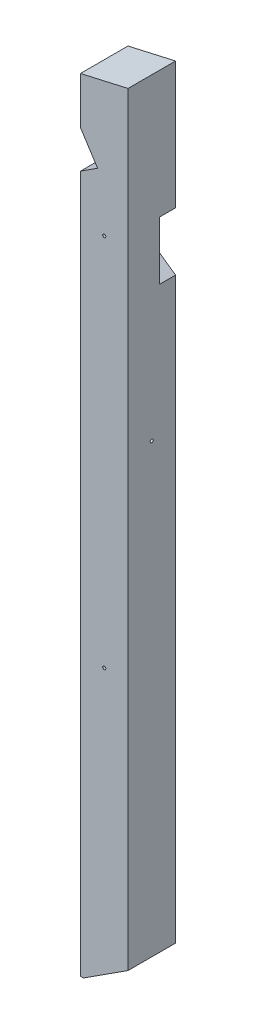
from build123d import *

# Parameters (mm, degrees)
SKETCH1_W           = 150
SKETCH1_H           = 150
BOSS_EXTRUDE1_DEPTH = 1250
SKETCH2_R           = 5
BOLTS_DEPTH         = 1262.199825563
TOPCUT_DEPTH        = 1262.199825563
ROOFCUT_DEPTH       = 1262.199825563
CUT_EXTRUDE4_DEPTH  = 1262.199825563
SKETCH6_R           = 5
CUT_EXTRUDE5_DEPTH  = 1262.199825563
CUT_EXTRUDE6_DEPTH  = 50


with BuildPart() as part:
    # Sketch1 → Boss-Extrude1 (new, symmetric)
    with BuildSketch(Plane(origin=(0, 0, 0), x_dir=(1, 0, 0), z_dir=(0, 1, 0))):
        Rectangle(SKETCH1_W, SKETCH1_H)
    extrude(amount=BOSS_EXTRUDE1_DEPTH, both=True)

    # Sketch2 → Bolts (cut, through all)
    with BuildSketch(Plane.XY.offset(75)):
        with Locations((0, 810)):
            Circle(SKETCH2_R)
        with Locations((0, -370)):
            Circle(SKETCH2_R)
    extrude(amount=-BOLTS_DEPTH, mode=Mode.SUBTRACT)

    # Sketch3 → TopCut (cut, through all)
    with BuildSketch(Plane.XY.offset(75)):
        Polygon((-75, 1068.159196847), (-20.84827249, 984.090234633), (-75, 949.20923319), align=None)
    extrude(amount=-TOPCUT_DEPTH, mode=Mode.SUBTRACT)

    # Sketch4 → RoofCut (cut, through all)
    with BuildSketch(Plane.XY.offset(75)):
        Polygon((75, 1250), (-75, 1215.956662981), (-75, 1250), align=None)
    extrude(amount=-ROOFCUT_DEPTH, mode=Mode.SUBTRACT)

    # Sketch5 → Cut-Extrude4 (cut, through all)
    with BuildSketch(Plane.XY.offset(75)):
        Polygon((75, -1159.47022319), (-65.544812434, -1250), (75, -1250), align=None)
    extrude(amount=-CUT_EXTRUDE4_DEPTH, mode=Mode.SUBTRACT)

    # Sketch6 → Cut-Extrude5 (cut, through all)
    with BuildSketch(Plane.ZY.offset(75)):
        with Locations((0, 250)):
            Circle(SKETCH6_R)
    extrude(amount=-CUT_EXTRUDE5_DEPTH, mode=Mode.SUBTRACT)

    # Sketch7 → Cut-Extrude6 (cut)
    with BuildSketch(Plane(origin=(0, 0, -75), x_dir=(-1, 0, 0), z_dir=(0, 0, -1))):
        Polygon((-75, 665.302341615), (75.500489844, 771.478930046), (75, 954.697658385), (-75, 848.874160527), align=None)
    extrude(amount=-CUT_EXTRUDE6_DEPTH, mode=Mode.SUBTRACT)


solid = part.part
